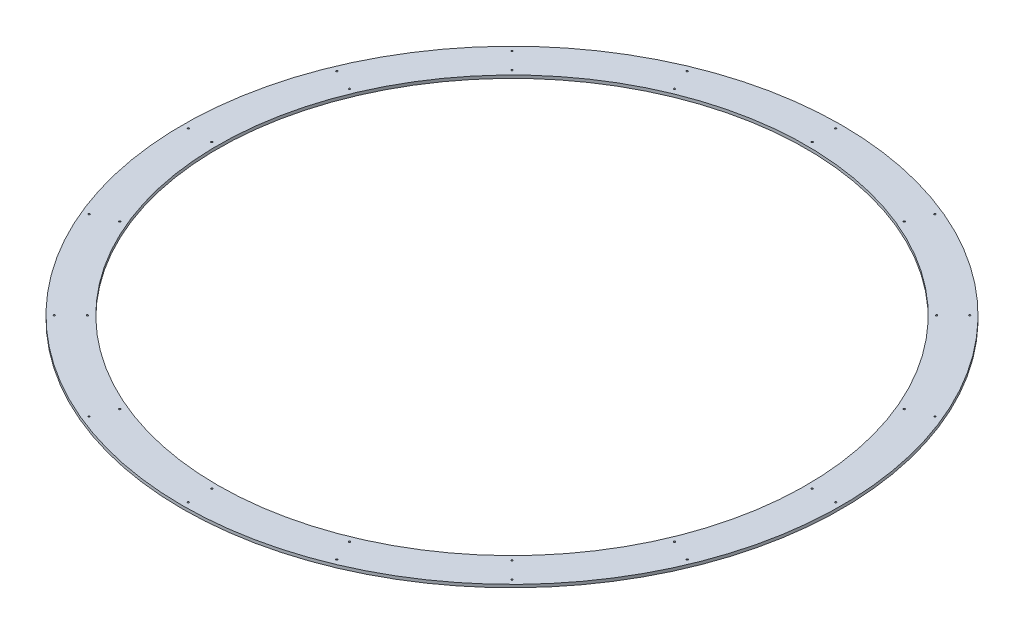
from build123d import *

# Parameters (mm, degrees)
SKETCH1_R           = 712.819772368
SKETCH1_R_2         = 636.619772368
TRACKTOP_DEPTH      = 6.35
SKETCH6_R           = 1.8288
MOUNTINGHOLES_DEPTH = 1009.099389076
CIRPATTERN3_COUNT   = 16


with BuildPart() as part:
    # Sketch1 → TrackTop (new body)
    with BuildSketch(Plane(origin=(0, 0, 0), x_dir=(1, 0, 0), z_dir=(0, 1, 0))):
        with Locations(Location((0, 0, 0), (0, 0, 270))):
            Circle(SKETCH1_R)
        with Locations(Location((0, 0, 0), (0, 0, 270))):
            Circle(SKETCH1_R_2, mode=Mode.SUBTRACT)
    extrude(amount=TRACKTOP_DEPTH)

    # Sketch6 → MountingHoles (cut, symmetric)
    with BuildSketch(Plane(origin=(0, 0, 0), x_dir=(1, 0, 0), z_dir=(0, 1, 0))):
        with Locations(Location((649.319772368, 0, 0), (0, 0, 270))):
            Circle(SKETCH6_R)
        with Locations(Location((700.119772368, 0, 0), (0, 0, 270))):
            Circle(SKETCH6_R)
    mountingholes = extrude(amount=MOUNTINGHOLES_DEPTH, both=True, mode=Mode.SUBTRACT)

    # CirPattern3: MountingHoles ×16 about axis
    cirpattern3_axis = Axis((0, 0, 0), (0, 1, 0))
    for i in range(1, CIRPATTERN3_COUNT):
        add(mountingholes.rotate(cirpattern3_axis, i * 360 / CIRPATTERN3_COUNT), mode=Mode.SUBTRACT)


solid = part.part
